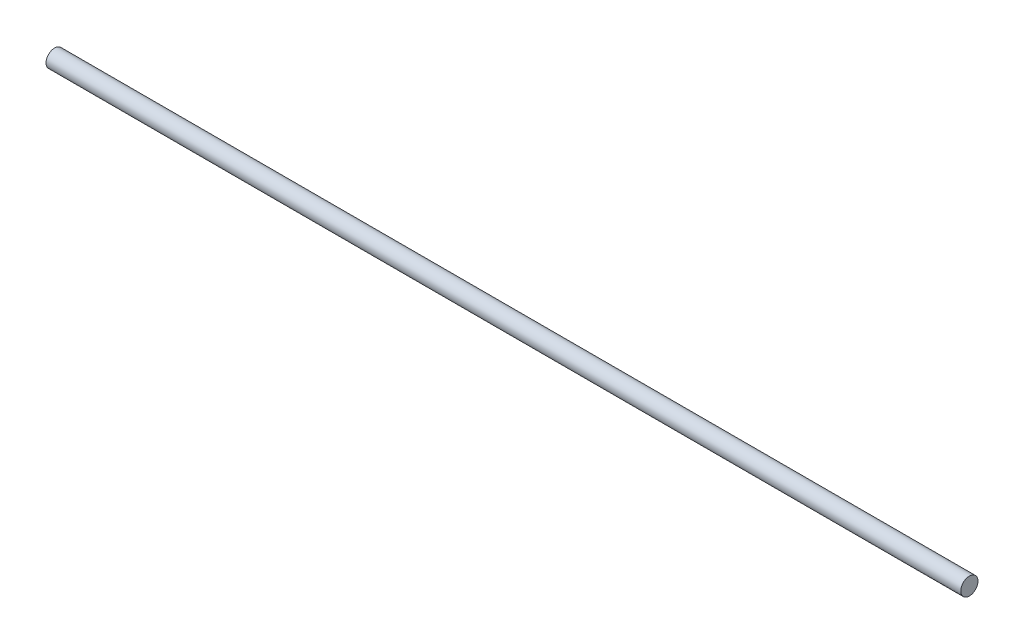
from build123d import *

# Parameters (mm, degrees)
ESQUISSE1_R        = 4
BOSS_EXTRU_1_DEPTH = 423.565319482


with BuildPart() as part:
    # Esquisse1 → Boss.-Extru.1 (new body)
    with BuildSketch(Plane(origin=(0, 0, 0), x_dir=(0, 0, -1), z_dir=(1, 0, 0))):
        with Locations(Location((0, 0, 0), (0, 0, 180))):
            Circle(ESQUISSE1_R)
    extrude(amount=BOSS_EXTRU_1_DEPTH)


solid = part.part
